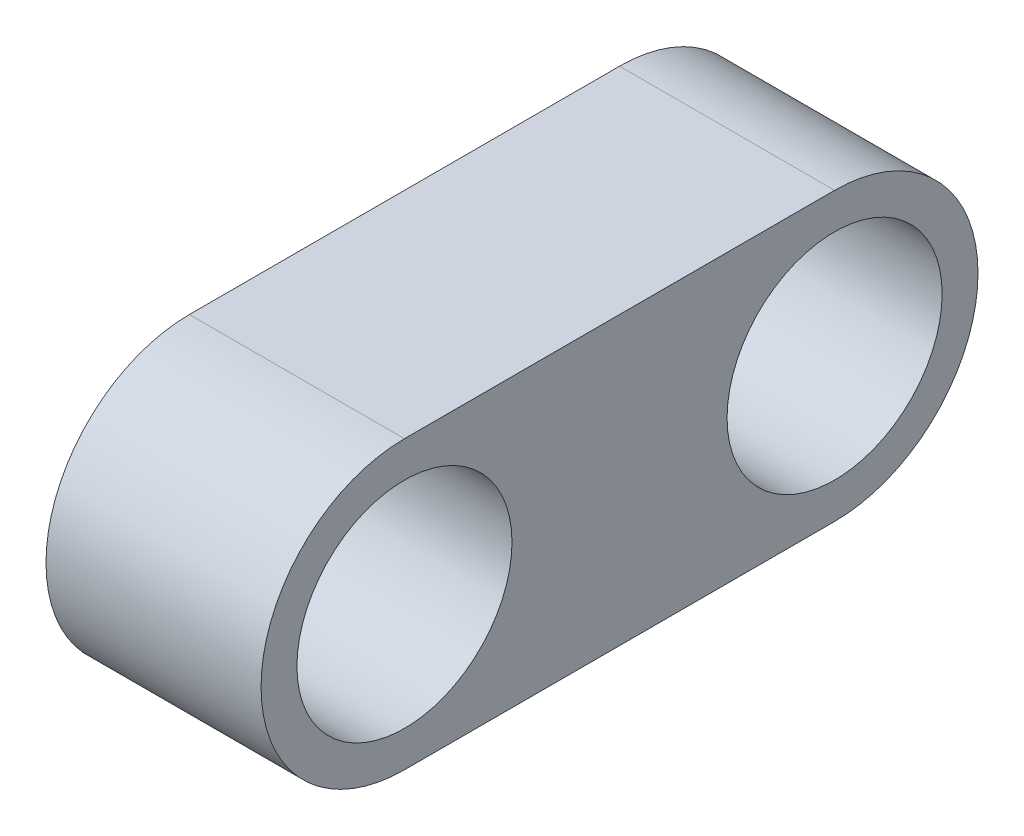
from build123d import *

# Parameters (mm, degrees)
BOSS_EXTRUDE1_DEPTH = 3


with BuildPart() as part:
    # Sketch2 → Boss-Extrude1 (new body)
    with BuildSketch(Plane(origin=(0, 0, 0), x_dir=(0, 0, -1), z_dir=(1, 0, 0))):
        with BuildLine():
            Line((6, 0), (0, 0))
            ThreePointArc((0, 0), (1.414213562, -0.585786438), (2, -2))
            Line((2, -2), (4, -2))
            ThreePointArc((4, -2), (4.585786438, -0.585786438), (6, 0))
        make_face()
        with BuildLine():
            Line((4, -2), (2, -2))
            ThreePointArc((2, -2), (1.414213562, -3.414213562), (0, -4))
            Line((0, -4), (6, -4))
            ThreePointArc((6, -4), (4.585786438, -3.414213562), (4, -2))
        make_face()
        with BuildLine():
            ThreePointArc((2, -2), (1.414213562, -0.585786438), (0, 0))
            ThreePointArc((0, 0), (-1.414213562, -0.585786438), (-2, -2))
            Line((-2, -2), (-1.5, -2))
            ThreePointArc((-1.5, -2), (0, -0.5), (1.5, -2))
            Line((1.5, -2), (2, -2))
        make_face()
        with BuildLine():
            ThreePointArc((0, -4), (1.414213562, -3.414213562), (2, -2))
            Line((2, -2), (1.5, -2))
            ThreePointArc((1.5, -2), (0, -3.5), (-1.5, -2))
            Line((-1.5, -2), (-2, -2))
            ThreePointArc((-2, -2), (-1.414213562, -3.414213562), (0, -4))
        make_face()
        with BuildLine():
            ThreePointArc((8, -2), (7.414213562, -0.585786438), (6, 0))
            ThreePointArc((6, 0), (4.585786438, -0.585786438), (4, -2))
            Line((4, -2), (4.5, -2))
            ThreePointArc((4.5, -2), (6, -0.5), (7.5, -2))
            Line((7.5, -2), (8, -2))
        make_face()
        with BuildLine():
            ThreePointArc((6, -4), (7.414213562, -3.414213562), (8, -2))
            Line((8, -2), (7.5, -2))
            ThreePointArc((7.5, -2), (6, -3.5), (4.5, -2))
            Line((4.5, -2), (4, -2))
            ThreePointArc((4, -2), (4.585786438, -3.414213562), (6, -4))
        make_face()
    extrude(amount=BOSS_EXTRUDE1_DEPTH)


solid = part.part
